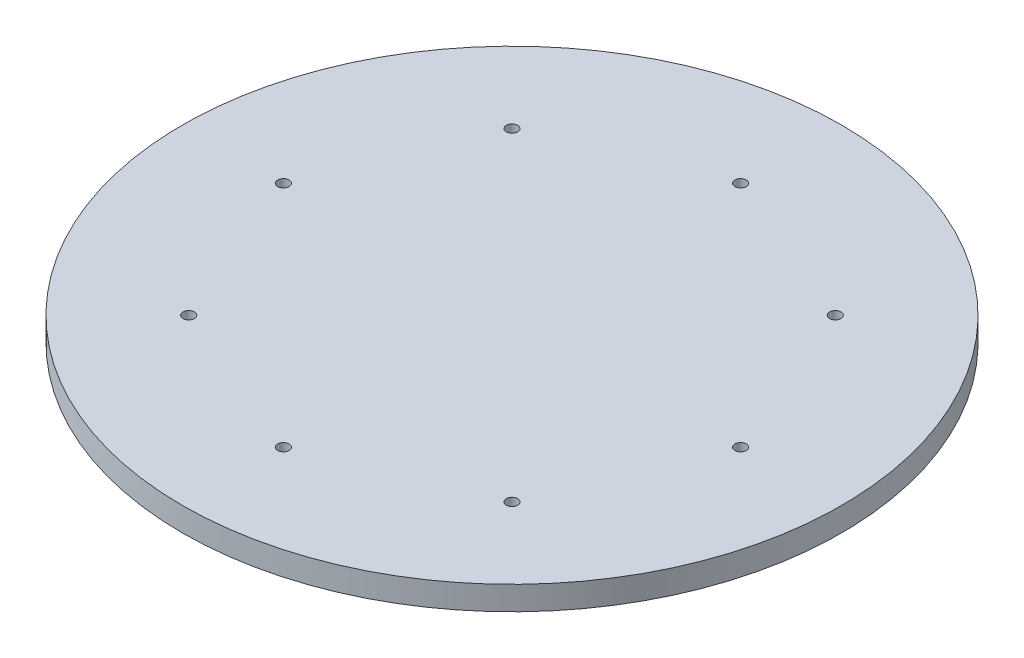
from build123d import *

# Parameters (mm, degrees)
SKETCH1_R           = 346
SKETCH1_R_2         = 6
BOSS_EXTRUDE1_DEPTH = 12.5
SKETCH2_R           = 317
SKETCH2_R_2         = 286
CUT_EXTRUDE1_DEPTH  = 12


with BuildPart() as part:
    # Sketch1 → Boss-Extrude1 (new, symmetric)
    with BuildSketch(Plane(origin=(0, 0, 0), x_dir=(1, 0, 0), z_dir=(0, 1, 0))):
        with Locations(Location((0, 0, 0), (0, 0, 270))):
            Circle(SKETCH1_R)
        with Locations(Location((0, 240, 0), (0, 0, 270))):
            Circle(SKETCH1_R_2, mode=Mode.SUBTRACT)
        with Locations(Location((169.705627485, 169.705627485, 0), (0, 0, 270))):
            Circle(SKETCH1_R_2, mode=Mode.SUBTRACT)
        with Locations(Location((240, 0, 0), (0, 0, 270))):
            Circle(SKETCH1_R_2, mode=Mode.SUBTRACT)
        with Locations(Location((169.705627485, -169.705627485, 0), (0, 0, 270))):
            Circle(SKETCH1_R_2, mode=Mode.SUBTRACT)
        with Locations(Location((0, -240, 0), (0, 0, 270))):
            Circle(SKETCH1_R_2, mode=Mode.SUBTRACT)
        with Locations(Location((-169.705627485, -169.705627485, 0), (0, 0, 270))):
            Circle(SKETCH1_R_2, mode=Mode.SUBTRACT)
        with Locations(Location((-240, 0, 0), (0, 0, 270))):
            Circle(SKETCH1_R_2, mode=Mode.SUBTRACT)
        with Locations(Location((-169.705627485, 169.705627485, 0), (0, 0, 270))):
            Circle(SKETCH1_R_2, mode=Mode.SUBTRACT)
    extrude(amount=BOSS_EXTRUDE1_DEPTH, both=True)

    # Sketch2 → Cut-Extrude1 (cut)
    with BuildSketch(Plane.XZ.offset(12.5)):
        with Locations(Location((0, 0, 0), (0, 0, 270))):
            Circle(SKETCH2_R)
        with Locations(Location((0, 0, 0), (0, 0, 270))):
            Circle(SKETCH2_R_2, mode=Mode.SUBTRACT)
    extrude(amount=-CUT_EXTRUDE1_DEPTH, mode=Mode.SUBTRACT)


solid = part.part
